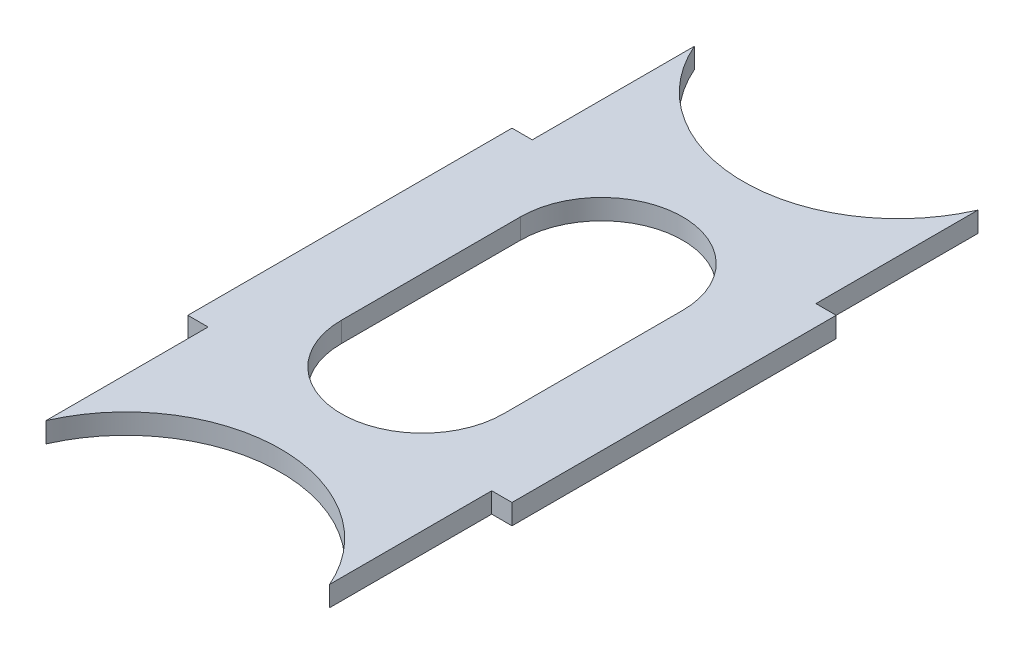
from build123d import *

# Parameters (mm, degrees)
SKETCH1_W           = 1.5875
SKETCH1_H           = 25.4
BOSS_EXTRUDE1_DEPTH = 1.5875


with BuildPart() as part:
    # Sketch1 → Boss-Extrude1 (new body)
    # profile 1 of 3: a face of its own
    with BuildSketch(Plane(origin=(0, 0, 0), x_dir=(1, 0, 0), z_dir=(0, 1, 0))):
        with BuildLine():
            Line((11.1125, -25.4), (11.1125, -12.7))
            Line((11.1125, -12.7), (11.1125, 12.7))
            Line((11.1125, 12.7), (11.1125, 25.4))
            ThreePointArc((11.1125, 25.4), (0, 18.132251925), (-11.1125, 25.4))
            Line((-11.1125, 25.4), (-11.1125, 12.7))
            Line((-11.1125, 12.7), (-11.1125, -12.7))
            Line((-11.1125, -12.7), (-11.1125, -25.4))
            ThreePointArc((-11.1125, -25.4), (0, -18.132251925), (11.1125, -25.4))
        make_face()
        with BuildLine():
            ThreePointArc((-6.35, 7.019751925), (0, 13.369751925), (6.35, 7.019751925))
            Line((6.35, 7.019751925), (6.35, -7.019751925))
            ThreePointArc((6.35, -7.019751925), (0, -13.369751925), (-6.35, -7.019751925))
            Line((-6.35, -7.019751925), (-6.35, 7.019751925))
        make_face(mode=Mode.SUBTRACT)
    # profile 2 of 3: a face of its own
    with BuildSketch(Plane(origin=(0, 0, 0), x_dir=(1, 0, 0), z_dir=(0, 1, 0))):
        with Locations((-11.90625, 0)):
            Rectangle(SKETCH1_W, SKETCH1_H)
    # profile 3 of 3: a face of its own
    with BuildSketch(Plane(origin=(0, 0, 0), x_dir=(1, 0, 0), z_dir=(0, 1, 0))):
        with Locations((11.90625, 0)):
            Rectangle(SKETCH1_W, SKETCH1_H)
    extrude(amount=BOSS_EXTRUDE1_DEPTH)


solid = part.part
